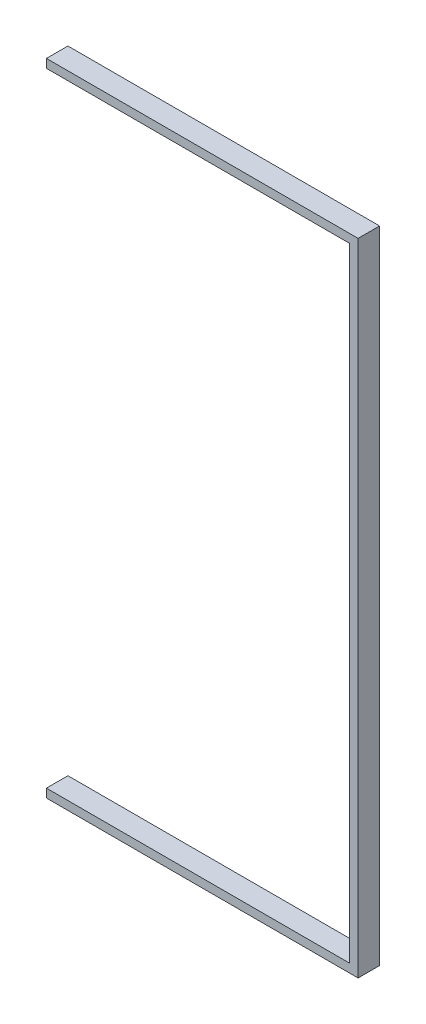
from build123d import *

# Parameters (mm, degrees)
EXTRUDE_1_DEPTH = 10


with BuildPart() as part:
    # Эскиз1 → Бобышка-Вытянуть1 (new body)
    with BuildSketch(Plane.XY):
        Polygon((-141, 41.01978691), (0, 41.01978691), (0, -248.98021309), (-141, -248.98021309), (-141, -252.98021309), (4, -252.98021309), (4, 45.01978691), (-141, 45.01978691), align=None)
    extrude(amount=EXTRUDE_1_DEPTH)


solid = part.part
